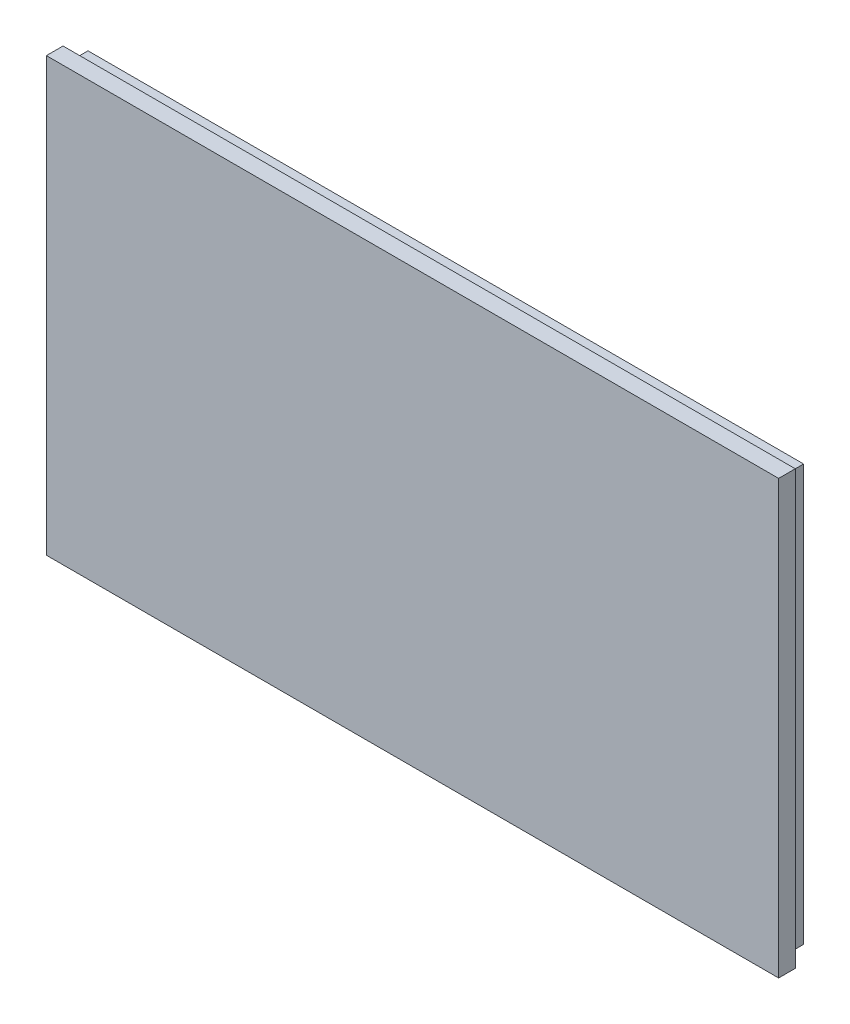
from build123d import *

# Parameters (mm, degrees)
SKETCH1_W           = 44
SKETCH1_H           = 26
BOSS_EXTRUDE1_DEPTH = 1
SKETCH2_W           = 43
SKETCH2_H           = 25
BOSS_EXTRUDE2_DEPTH = 1


with BuildPart() as part:
    # Sketch1 → Boss-Extrude1 (new body)
    with BuildSketch(Plane.XY):
        Rectangle(SKETCH1_W, SKETCH1_H)
    extrude(amount=BOSS_EXTRUDE1_DEPTH)

    # Sketch2 → Boss-Extrude2 (add)
    with BuildSketch(Plane(origin=(0, 0, 0), x_dir=(-1, 0, 0), z_dir=(0, 0, -1))):
        Rectangle(SKETCH2_W, SKETCH2_H)
    extrude(amount=BOSS_EXTRUDE2_DEPTH)


solid = part.part
